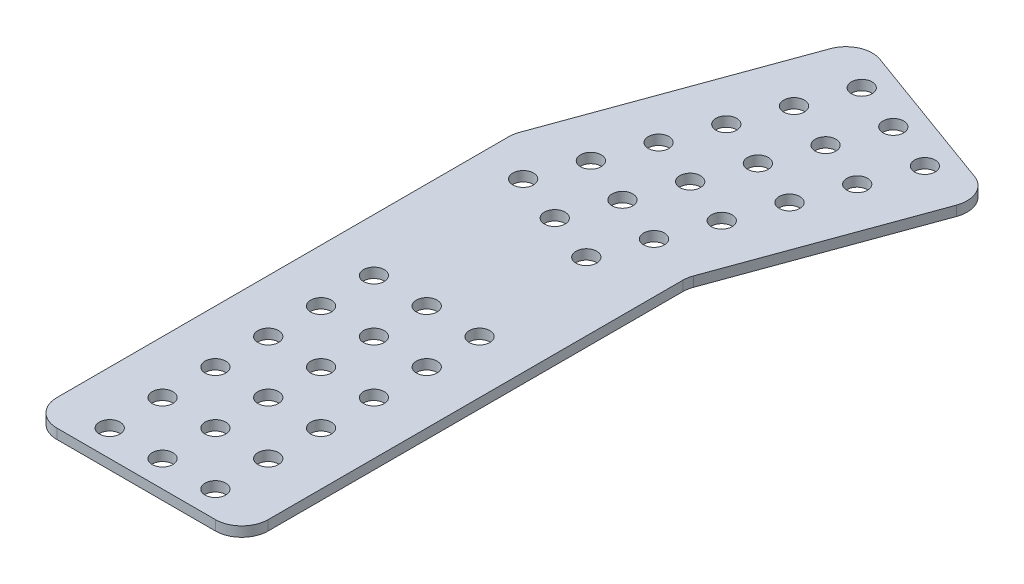
from build123d import *

# Parameters (mm, degrees)
SKETCH1_W           = 50.8
SKETCH1_H           = 76.2
SKETCH1_R           = 2.4892
BOSS_EXTRUDE1_DEPTH = 2.38125
FILLET1_R           = 6.35


with BuildPart() as part:
    # Sketch1 → Boss-Extrude1 (new body)
    # profile 1 of 3: a face of its own
    with BuildSketch(Plane(origin=(0, 0, 0), x_dir=(1, 0, 0), z_dir=(0, 1, 0))):
        with Locations((-99.145518613, -345.905622456)):
            Rectangle(SKETCH1_W, SKETCH1_H)
        with Locations(Location((-86.445518613, -326.855622456, 0), (0, 0, 90))):
            Circle(SKETCH1_R, mode=Mode.SUBTRACT)
        with Locations(Location((-86.445518613, -352.255622456, 0), (0, 0, 90))):
            Circle(SKETCH1_R, mode=Mode.SUBTRACT)
        with Locations(Location((-86.445518613, -377.655622456, 0), (0, 0, 90))):
            Circle(SKETCH1_R, mode=Mode.SUBTRACT)
        with Locations(Location((-99.145518613, -326.855622456, 0), (0, 0, 90))):
            Circle(SKETCH1_R, mode=Mode.SUBTRACT)
        with Locations(Location((-99.145518613, -352.255622456, 0), (0, 0, 90))):
            Circle(SKETCH1_R, mode=Mode.SUBTRACT)
        with Locations(Location((-99.145518613, -377.655622456, 0), (0, 0, 90))):
            Circle(SKETCH1_R, mode=Mode.SUBTRACT)
        with Locations(Location((-111.845518613, -377.655622456, 0), (0, 0, 90))):
            Circle(SKETCH1_R, mode=Mode.SUBTRACT)
        with Locations(Location((-111.845518613, -364.955622456, 0), (0, 0, 90))):
            Circle(SKETCH1_R, mode=Mode.SUBTRACT)
        with Locations(Location((-111.845518613, -352.255622456, 0), (0, 0, 90))):
            Circle(SKETCH1_R, mode=Mode.SUBTRACT)
        with Locations(Location((-111.845518613, -339.555622456, 0), (0, 0, 90))):
            Circle(SKETCH1_R, mode=Mode.SUBTRACT)
        with Locations(Location((-111.845518613, -326.855622456, 0), (0, 0, 90))):
            Circle(SKETCH1_R, mode=Mode.SUBTRACT)
        with Locations(Location((-111.845518613, -314.155622456, 0), (0, 0, 90))):
            Circle(SKETCH1_R, mode=Mode.SUBTRACT)
        with Locations(Location((-99.145518613, -364.955622456, 0), (0, 0, 90))):
            Circle(SKETCH1_R, mode=Mode.SUBTRACT)
        with Locations(Location((-99.145518613, -339.555622456, 0), (0, 0, 90))):
            Circle(SKETCH1_R, mode=Mode.SUBTRACT)
        with Locations(Location((-99.145518613, -314.155622456, 0), (0, 0, 90))):
            Circle(SKETCH1_R, mode=Mode.SUBTRACT)
        with Locations(Location((-86.445518613, -364.955622456, 0), (0, 0, 90))):
            Circle(SKETCH1_R, mode=Mode.SUBTRACT)
        with Locations(Location((-86.445518613, -339.555622456, 0), (0, 0, 90))):
            Circle(SKETCH1_R, mode=Mode.SUBTRACT)
        with Locations(Location((-86.445518613, -314.155622456, 0), (0, 0, 90))):
            Circle(SKETCH1_R, mode=Mode.SUBTRACT)
    # profile 2 of 3: a face of its own
    with BuildSketch(Plane(origin=(0, 0, 0), x_dir=(1, 0, 0), z_dir=(0, 1, 0))):
        Polygon((-73.745518613, -307.805622456), (-124.545518613, -307.805622456), (-124.545518613, -267.92136832), (-73.745518613, -286.411056221), align=None)
        with Locations(Location((-102.075911776, -280.451262674, 0), (0, 0, 90))):
            Circle(SKETCH1_R, mode=Mode.SUBTRACT)
        with Locations(Location((-114.01000806, -276.107606853, 0), (0, 0, 90))):
            Circle(SKETCH1_R, mode=Mode.SUBTRACT)
        with Locations(Location((-90.141815492, -284.794918494, 0), (0, 0, 90))):
            Circle(SKETCH1_R, mode=Mode.SUBTRACT)
    # profile 3 of 3: a face of its own
    with BuildSketch(Plane(origin=(0, 0, 0), x_dir=(1, 0, 0), z_dir=(0, 1, 0))):
        Polygon((-124.545518613, -267.92136832), (-73.745518613, -286.411056221), (-73.745518613, -276.87877894), (-54.317612196, -223.501044752), (-102.053997332, -206.126421471), align=None)
        with Locations(Location((-109.666352239, -264.173510569, 0), (0, 0, 90))):
            Circle(SKETCH1_R, mode=Mode.SUBTRACT)
        with Locations(Location((-105.322696419, -252.239414285, 0), (0, 0, 90))):
            Circle(SKETCH1_R, mode=Mode.SUBTRACT)
        with Locations(Location((-97.732255955, -268.51716639, 0), (0, 0, 90))):
            Circle(SKETCH1_R, mode=Mode.SUBTRACT)
        with Locations(Location((-93.388600135, -256.583070106, 0), (0, 0, 90))):
            Circle(SKETCH1_R, mode=Mode.SUBTRACT)
        with Locations(Location((-100.979040599, -240.305318001, 0), (0, 0, 90))):
            Circle(SKETCH1_R, mode=Mode.SUBTRACT)
        with Locations(Location((-96.635384779, -228.371221717, 0), (0, 0, 90))):
            Circle(SKETCH1_R, mode=Mode.SUBTRACT)
        with Locations(Location((-92.291728958, -216.437125433, 0), (0, 0, 90))):
            Circle(SKETCH1_R, mode=Mode.SUBTRACT)
        with Locations(Location((-85.798159671, -272.86082221, 0), (0, 0, 90))):
            Circle(SKETCH1_R, mode=Mode.SUBTRACT)
        with Locations(Location((-81.454503851, -260.926725926, 0), (0, 0, 90))):
            Circle(SKETCH1_R, mode=Mode.SUBTRACT)
        with Locations(Location((-89.044944315, -244.648973822, 0), (0, 0, 90))):
            Circle(SKETCH1_R, mode=Mode.SUBTRACT)
        with Locations(Location((-84.701288495, -232.714877538, 0), (0, 0, 90))):
            Circle(SKETCH1_R, mode=Mode.SUBTRACT)
        with Locations(Location((-77.110848031, -248.992629642, 0), (0, 0, 90))):
            Circle(SKETCH1_R, mode=Mode.SUBTRACT)
        with Locations(Location((-72.767192211, -237.058533358, 0), (0, 0, 90))):
            Circle(SKETCH1_R, mode=Mode.SUBTRACT)
        with Locations(Location((-80.357632674, -220.780781254, 0), (0, 0, 90))):
            Circle(SKETCH1_R, mode=Mode.SUBTRACT)
        with Locations(Location((-68.42353639, -225.124437074, 0), (0, 0, 90))):
            Circle(SKETCH1_R, mode=Mode.SUBTRACT)
    extrude(amount=BOSS_EXTRUDE1_DEPTH)

    # Fillet1
    fillet1_edges = [part.edges().sort_by_distance(p)[0] for p in [
        (-73.745518613, 1.190625, 384.005622456),
        (-124.545518613, 1.190625, 384.005622456),
        (-124.545518613, 1.190625, 267.92136832),
        (-102.053997332, 1.190625, 206.126421471),
        (-54.317612196, 1.190625, 223.501044752),
        (-73.745518613, 1.190625, 276.87877894),
    ]]
    fillet(fillet1_edges, radius=FILLET1_R)


solid = part.part
